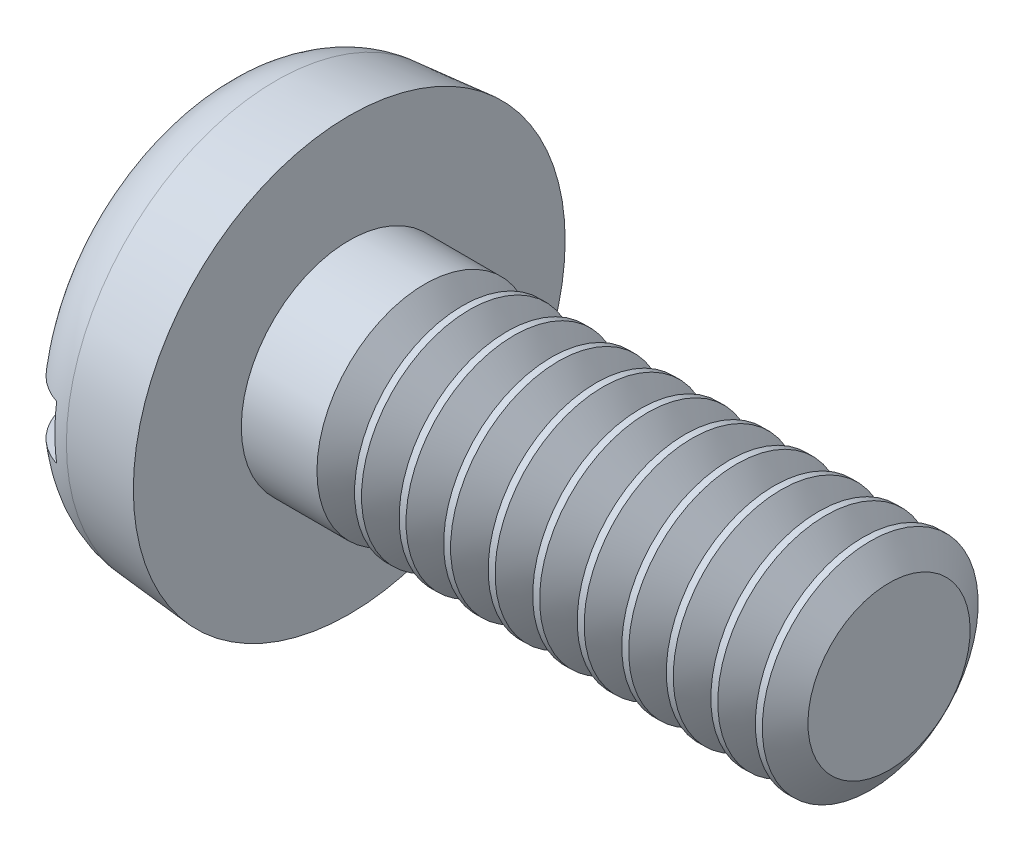
from build123d import *

# Parameters (mm, degrees)
FILLET2_R       = 0.5
SKETCH2_W       = 3.2
SKETCH2_H       = 0.4
SLOT_DEPTH      = 0.35
THDSCHPAT_COUNT = 11
THDSCHPAT_PITCH = 0.33


with BuildPart() as part:
    # BodySke → Base-Revolve (revolve)
    with BuildSketch(Plane.XY, mode=Mode.PRIVATE) as base_revolve_sk:
        Polygon((1, 0.8), (1, 1.6), (0, 1.512511336), (0, 0), (5, 0), (5, 0.8), align=None)
    revolve(base_revolve_sk.sketch.rotate(Axis((-25.4, 0, 0), (1, 0, 0)), 90), axis=Axis((-25.4, 0, 0), (1, 0, 0)))

    # Fillet2
    fillet2_edges = [part.edges().sort_by_distance(p)[0] for p in [
        (0, 0, -1.512511336),
    ]]
    fillet(fillet2_edges, radius=FILLET2_R)

    # Sketch2 → Slot (cut)
    with BuildSketch(Plane(origin=(0, 0, 0), x_dir=(0, 0, -1), z_dir=(1, 0, 0))):
        Rectangle(SKETCH2_W, SKETCH2_H)
    extrude(amount=SLOT_DEPTH, mode=Mode.SUBTRACT)

    # ThdSchSke → ThreadSchematic (revolve, cut)
    with BuildSketch(Plane.XY, mode=Mode.PRIVATE) as threadschematic_sk:
        Polygon((1.7, -0.601), (1.5606587, -0.8), (1.5606587, -1), (1.8393413, -1), (1.8393413, -0.8), align=None)
    threadschematic = revolve(threadschematic_sk.sketch.rotate(Axis((-3.175, 0, 0), (1, 0, 0)), 270), axis=Axis((-3.175, 0, 0), (1, 0, 0)), mode=Mode.SUBTRACT)

    # ThdSchPat: ThreadSchematic ×11
    with Locations(*[(i * THDSCHPAT_PITCH, 0, 0) for i in range(1, THDSCHPAT_COUNT)]):
        add(threadschematic, mode=Mode.SUBTRACT)


solid = part.part
